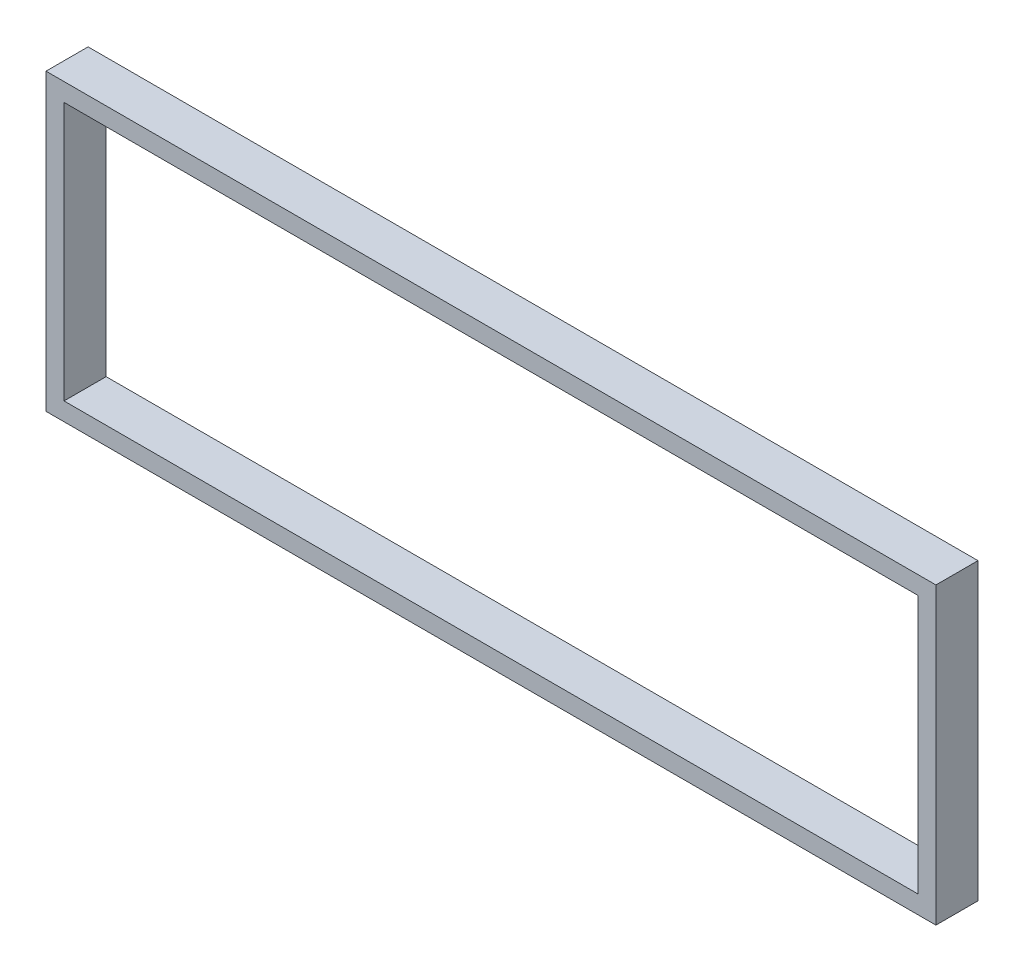
from build123d import *

# Parameters (mm, degrees)
SKETCH1_W     = 148
SKETCH1_H     = 49
SKETCH1_W_2   = 142
SKETCH1_H_2   = 43
PROFILE_DEPTH = 7


with BuildPart() as part:
    # Sketch1 → Profile (new body)
    with BuildSketch(Plane.XY):
        with Locations((74, 24.5)):
            Rectangle(SKETCH1_W, SKETCH1_H)
        with Locations((74, 24.5)):
            Rectangle(SKETCH1_W_2, SKETCH1_H_2, mode=Mode.SUBTRACT)
    extrude(amount=PROFILE_DEPTH)


solid = part.part
